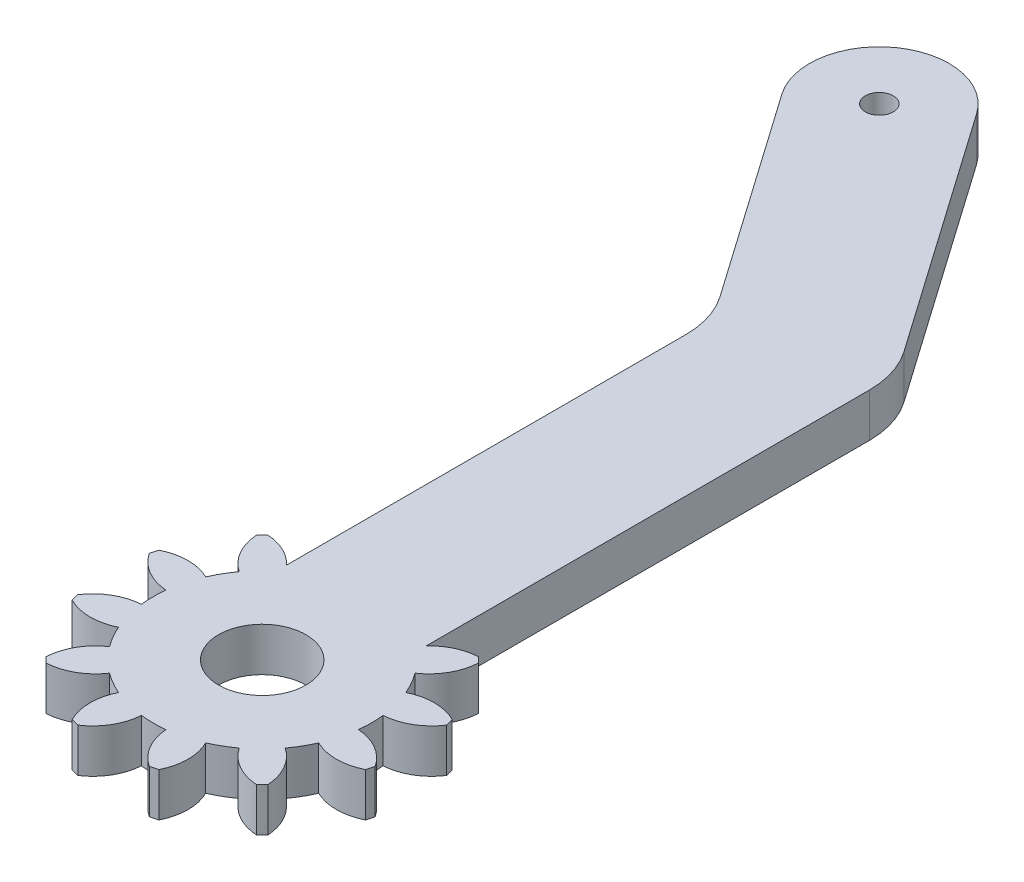
from build123d import *

# Parameters (mm, degrees)
BOSS_EXTRUDE1_DEPTH = 5
FILLET1_RADIUS      = 8
FILLET1_LENGTH      = 5
FILLET2_R           = 10
SKETCH2_R           = 1.6
CUT_EXTRUDE2_DEPTH  = 103.399978443
BOSS_EXTRUDE3_DEPTH = 5
SKETCH6_R           = 5
CUT_EXTRUDE3_DEPTH  = 103.399978443


with BuildPart() as part:
    # Sketch1 → Boss-Extrude1 (new body)
    with BuildSketch(Plane(origin=(0, 0, 0), x_dir=(1, 0, 0), z_dir=(0, 1, 0))):
        with BuildLine():
            Line((8, 9.604686356), (8, 64.67016599))
            Line((8, 64.67016599), (-17.836624745, 101.568690121))
            Line((-17.836624745, 101.568690121), (-30.943057454, 92.391467139))
            Line((-30.943057454, 92.391467139), (-8, 59.625385368))
            Line((-8, 59.625385368), (-8, 9.604686356))
            ThreePointArc((-8, 9.604686356), (0, -12.5), (8, 9.604686356))
        make_face()
    extrude(amount=BOSS_EXTRUDE1_DEPTH)

    # Fillet1: full round fillet: the end face becomes a half cylinder, R = half its width
    fillet1_face = Plane((-24.3898411, 2.5, -96.98007863), x_dir=(0, 1, 0), z_dir=(-0.573576436351, 0, -0.819152044289))  # on the end face: x along it, z out of the body
    fillet1_slab = fillet1_face.offset(-FILLET1_RADIUS / 2) * Box(FILLET1_LENGTH, 2 * FILLET1_RADIUS, FILLET1_RADIUS, mode=Mode.PRIVATE)  # the body's end, R deep
    fillet1_round = Plane((-19.801229609, 2.5, -90.426862276), x_dir=(-0.573576436351, 0, -0.819152044289), z_dir=(0, 1, 0)) * Cylinder(FILLET1_RADIUS, FILLET1_LENGTH, mode=Mode.PRIVATE)  # its axis R under the face
    add(fillet1_slab - fillet1_round, mode=Mode.SUBTRACT)

    # Fillet2
    fillet2_edges = [part.edges().sort_by_distance(p)[0] for p in [
        (-8, 2.5, -59.625385368),
        (8, 2.5, -64.67016599),
    ]]
    fillet(fillet2_edges, radius=FILLET2_R)

    # Sketch2 → Cut-Extrude2 (cut, through all)
    with BuildSketch(Plane(origin=(0, 5, 0), x_dir=(1, 0, 0), z_dir=(0, 1, 0))):
        with Locations(Location((-19.801229609, 90.426862276, 0), (0, 0, 270))):
            Circle(SKETCH2_R)
    extrude(amount=-CUT_EXTRUDE2_DEPTH, mode=Mode.SUBTRACT)

    # Sketch5 → Boss-Extrude3 (add)
    with BuildSketch(Plane(origin=(0, 5, 0), x_dir=(1, 0, 0), z_dir=(0, 1, 0))):
        with BuildLine():
            ThreePointArc((-12.051706508, -12.688828561), (-9.162245044, -11.749370601), (-7.103491322, -9.514845613))
            ThreePointArc((-7.103491322, -9.514845613), (-5.937, -10.283185645), (-4.688352353, -10.909226747))
            ThreePointArc((-4.688352353, -10.909226747), (-5.594130897, -13.809422264), (-4.962994624, -16.781498275))
            ThreePointArc((-4.962994624, -16.781498275), (-4.529333289, -16.90370196), (-4.092669715, -17.014701132))
            ThreePointArc((-4.092669715, -17.014701132), (-2.060051663, -14.756375941), (-1.394381134, -11.791843675))
            ThreePointArc((-1.394381134, -11.791843675), (0, -11.874), (1.394381134, -11.791843675))
            ThreePointArc((1.394381134, -11.791843675), (2.060051663, -14.756375941), (4.092669715, -17.014701132))
            ThreePointArc((4.092669715, -17.014701132), (4.529333289, -16.90370196), (4.962994624, -16.781498275))
            ThreePointArc((4.962994624, -16.781498275), (5.594130897, -13.809422264), (4.688352353, -10.909226747))
            ThreePointArc((4.688352353, -10.909226747), (5.937, -10.283185645), (7.103491322, -9.514845613))
            ThreePointArc((7.103491322, -9.514845613), (9.162245044, -11.749370601), (12.051706508, -12.688828561))
            ThreePointArc((12.051706508, -12.688828561), (12.374368671, -12.374368671), (12.688828561, -12.051706508))
            ThreePointArc((12.688828561, -12.051706508), (11.749370601, -9.162245044), (9.514845613, -7.103491322))
            ThreePointArc((9.514845613, -7.103491322), (10.283185645, -5.937), (10.909226747, -4.688352353))
            ThreePointArc((10.909226747, -4.688352353), (13.809422264, -5.594130897), (16.781498275, -4.962994624))
            ThreePointArc((16.781498275, -4.962994624), (16.90370196, -4.529333289), (17.014701132, -4.092669715))
            ThreePointArc((17.014701132, -4.092669715), (14.756375941, -2.060051663), (11.791843675, -1.394381134))
            ThreePointArc((11.791843675, -1.394381134), (11.874, 0), (11.791843675, 1.394381134))
            ThreePointArc((11.791843675, 1.394381134), (14.756375941, 2.060051663), (17.014701132, 4.092669715))
            ThreePointArc((17.014701132, 4.092669715), (16.90370196, 4.529333289), (16.781498275, 4.962994624))
            ThreePointArc((16.781498275, 4.962994624), (13.809422264, 5.594130897), (10.909226747, 4.688352353))
            ThreePointArc((10.909226747, 4.688352353), (10.283185645, 5.937), (9.514845613, 7.103491322))
            ThreePointArc((9.514845613, 7.103491322), (11.749370601, 9.162245044), (12.688828561, 12.051706508))
            ThreePointArc((12.688828561, 12.051706508), (12.374368671, 12.374368671), (12.051706508, 12.688828561))
            ThreePointArc((12.051706508, 12.688828561), (9.162245044, 11.749370601), (7.103491322, 9.514845613))
            ThreePointArc((7.103491322, 9.514845613), (5.937, 10.283185645), (4.688352353, 10.909226747))
            ThreePointArc((4.688352353, 10.909226747), (5.594130897, 13.809422264), (4.962994624, 16.781498275))
            ThreePointArc((4.962994624, 16.781498275), (4.529333289, 16.90370196), (4.092669715, 17.014701132))
            ThreePointArc((4.092669715, 17.014701132), (2.060051663, 14.756375941), (1.394381134, 11.791843675))
            ThreePointArc((1.394381134, 11.791843675), (0, 11.874), (-1.394381134, 11.791843675))
            ThreePointArc((-1.394381134, 11.791843675), (-2.060051663, 14.756375941), (-4.092669715, 17.014701132))
            ThreePointArc((-4.092669715, 17.014701132), (-4.529333289, 16.90370196), (-4.962994624, 16.781498275))
            ThreePointArc((-4.962994624, 16.781498275), (-5.594130897, 13.809422264), (-4.688352353, 10.909226747))
            ThreePointArc((-4.688352353, 10.909226747), (-5.937, 10.283185645), (-7.103491322, 9.514845613))
            ThreePointArc((-7.103491322, 9.514845613), (-9.162245044, 11.749370601), (-12.051706508, 12.688828561))
            ThreePointArc((-12.051706508, 12.688828561), (-12.374368671, 12.374368671), (-12.688828561, 12.051706508))
            ThreePointArc((-12.688828561, 12.051706508), (-11.749370601, 9.162245044), (-9.514845613, 7.103491322))
            ThreePointArc((-9.514845613, 7.103491322), (-10.283185645, 5.937), (-10.909226747, 4.688352353))
            ThreePointArc((-10.909226747, 4.688352353), (-13.809422264, 5.594130897), (-16.781498275, 4.962994624))
            ThreePointArc((-16.781498275, 4.962994624), (-16.90370196, 4.529333289), (-17.014701132, 4.092669715))
            ThreePointArc((-17.014701132, 4.092669715), (-14.756375941, 2.060051663), (-11.791843675, 1.394381134))
            ThreePointArc((-11.791843675, 1.394381134), (-11.874, 0), (-11.791843675, -1.394381134))
            ThreePointArc((-11.791843675, -1.394381134), (-14.756375941, -2.060051663), (-17.014701132, -4.092669715))
            ThreePointArc((-17.014701132, -4.092669715), (-16.90370196, -4.529333289), (-16.781498275, -4.962994624))
            ThreePointArc((-16.781498275, -4.962994624), (-13.809422264, -5.594130897), (-10.909226747, -4.688352353))
            ThreePointArc((-10.909226747, -4.688352353), (-10.283185645, -5.937), (-9.514845613, -7.103491322))
            ThreePointArc((-9.514845613, -7.103491322), (-11.749370601, -9.162245044), (-12.688828561, -12.051706508))
            ThreePointArc((-12.688828561, -12.051706508), (-12.374368671, -12.374368671), (-12.051706508, -12.688828561))
        make_face()
    extrude(amount=-BOSS_EXTRUDE3_DEPTH)

    # Sketch6 → Cut-Extrude3 (cut, through all)
    with BuildSketch(Plane(origin=(0, 5, 0), x_dir=(1, 0, 0), z_dir=(0, 1, 0))):
        with Locations(Location((0, 0, 0), (0, 0, 270))):
            Circle(SKETCH6_R)
    extrude(amount=-CUT_EXTRUDE3_DEPTH, mode=Mode.SUBTRACT)


solid = part.part
